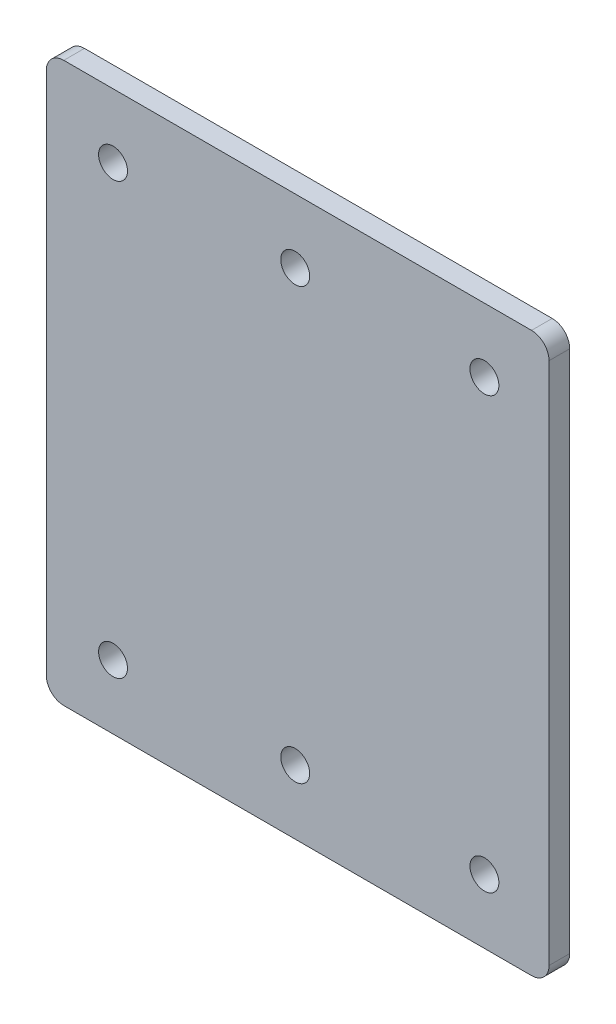
from build123d import *

# Parameters (mm, degrees)
BOSS_EXTRUDE1_DEPTH = 2.9972
SKETCH3_R           = 2.0955
CUT_EXTRUDE1_DEPTH  = 55.578530374


with BuildPart() as part:
    # Sketch2 → Boss-Extrude1 (new body)
    with BuildSketch(Plane.XY):
        with BuildLine():
            Line((-36.449, -37.973), (-36.449, 37.973))
            ThreePointArc((-36.449, 37.973), (-35.705051224, 39.769051224), (-33.909, 40.513))
            Line((-33.909, 40.513), (33.909, 40.513))
            ThreePointArc((33.909, 40.513), (35.705051224, 39.769051224), (36.449, 37.973))
            Line((36.449, 37.973), (36.449, -37.973))
            ThreePointArc((36.449, -37.973), (35.705051224, -39.769051224), (33.909, -40.513))
            Line((33.909, -40.513), (-33.909, -40.513))
            ThreePointArc((-33.909, -40.513), (-35.705051224, -39.769051224), (-36.449, -37.973))
        make_face()
    extrude(amount=-BOSS_EXTRUDE1_DEPTH)

    # Sketch3 → Cut-Extrude1 (cut, through all)
    with BuildSketch(Plane.XY):
        with Locations((-26.7716, 31.2166)):
            Circle(SKETCH3_R)
        with Locations((-0.3556, 31.2166)):
            Circle(SKETCH3_R)
        with Locations((27.0764, 31.2166)):
            Circle(SKETCH3_R)
        with Locations((27.0764, -31.2166)):
            Circle(SKETCH3_R)
        with Locations((-0.3556, -31.2166)):
            Circle(SKETCH3_R)
        with Locations((-26.7716, -31.2166)):
            Circle(SKETCH3_R)
    extrude(amount=-CUT_EXTRUDE1_DEPTH, mode=Mode.SUBTRACT)


solid = part.part
